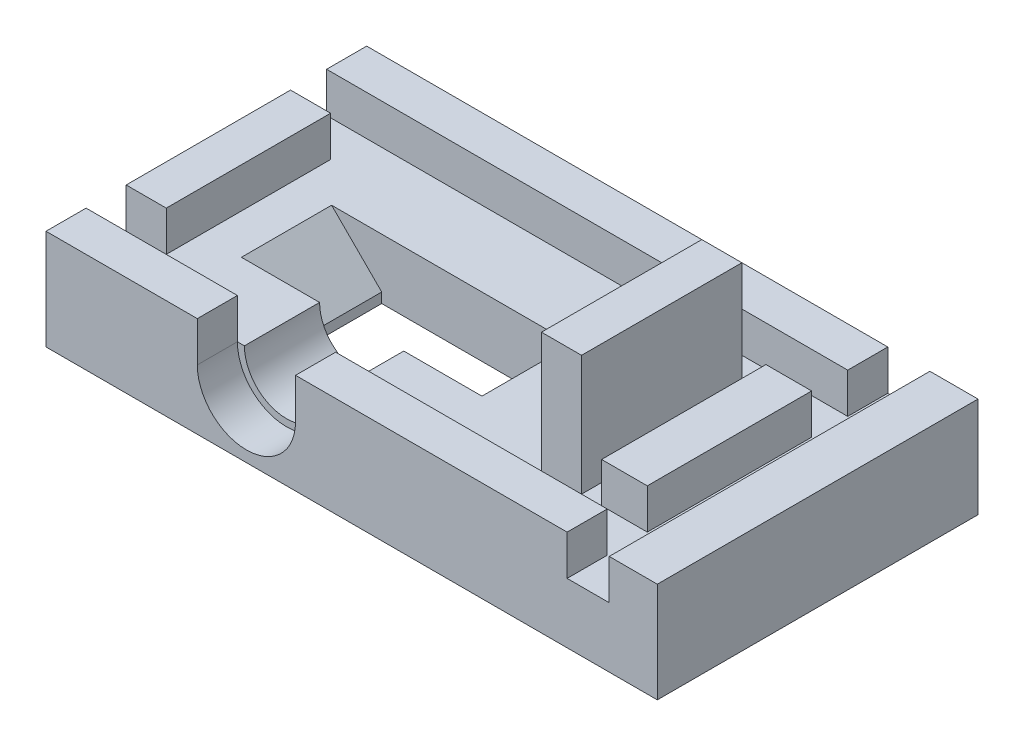
from build123d import *

# Parameters (mm, degrees)
BOSS_EXTRUDE1_DEPTH      = 2
BOSS_EXTRUDE1_DEPTH_BACK = 1
SKETCH1_W                = 30.5
SKETCH1_H                = 16
SKETCH2_W                = 2.4
SKETCH2_H                = 16
SKETCH2_W_2              = 26
SKETCH2_H_2              = 2
SKETCH2_W_3              = 2
SKETCH2_H_3              = 8.2
SKETCH2_W_4              = 2.279749354
BOSS_EXTRUDE2_DEPTH      = 2
SKETCH3_W                = 2
SKETCH3_H                = 8
BOSS_EXTRUDE3_DEPTH      = 6
SKETCH4_W                = 7
SKETCH4_H                = 4.5
CUT_EXTRUDE1_DEPTH       = 3
CUT_EXTRUDE2_DEPTH       = 7
CUT_EXTRUDE3_DEPTH       = 2
CHAMFER1_SIZE            = 2.5


with BuildPart() as part:
    # Sketch1 → Boss-Extrude1 (new, two sides: drawn at the far end of the back side and taken through both)
    with BuildSketch(Plane(origin=(0, 0, 0), x_dir=(1, 0, 0), z_dir=(0, 1, 0)).offset(-BOSS_EXTRUDE1_DEPTH_BACK)):
        Rectangle(SKETCH1_W, SKETCH1_H)
    extrude(amount=BOSS_EXTRUDE1_DEPTH + BOSS_EXTRUDE1_DEPTH_BACK)

    # Sketch2 → Boss-Extrude2 (add)
    with BuildSketch(Plane(origin=(0, 2, 0), x_dir=(1, 0, 0), z_dir=(0, 1, 0))):
        with Locations((14.05, 0)):
            Rectangle(SKETCH2_W, SKETCH2_H)
        with Locations((-2.25, 7)):
            Rectangle(SKETCH2_W_2, SKETCH2_H_2)
        with Locations((-2.25, -7)):
            Rectangle(SKETCH2_W_2, SKETCH2_H_2)
        with Locations((-14.25, 0.1)):
            Rectangle(SKETCH2_W_3, SKETCH2_H_3)
        with Locations((9.610125323, 0.1)):
            Rectangle(SKETCH2_W_4, SKETCH2_H_3)
    extrude(amount=BOSS_EXTRUDE2_DEPTH)

    # Sketch3 → Boss-Extrude3 (add)
    with BuildSketch(Plane(origin=(0, 2, 0), x_dir=(1, 0, 0), z_dir=(0, 1, 0))):
        with Locations((6.470250646, 0)):
            Rectangle(SKETCH3_W, SKETCH3_H)
    extrude(amount=BOSS_EXTRUDE3_DEPTH)

    # Sketch4 → Cut-Extrude1 (cut)
    with BuildSketch(Plane(origin=(0, 2, 0), x_dir=(1, 0, 0), z_dir=(0, 1, 0))):
        with Locations((-5.25, 0)):
            Rectangle(SKETCH4_W, SKETCH4_H)
    extrude(amount=-CUT_EXTRUDE1_DEPTH, mode=Mode.SUBTRACT)

    # Sketch5 → Cut-Extrude2 (cut)
    with BuildSketch(Plane(origin=(0, 0, 8), x_dir=(-1, 0, 0), z_dir=(0, 0, -1))):
        with BuildLine():
            Line((3.15, 2), (3.15, 4.2))
            Line((3.15, 4.2), (7.35, 4.2))
            Line((7.35, 4.2), (7.35, 2))
            ThreePointArc((7.35, 2), (5.25, -0.1), (3.15, 2))
        make_face()
    extrude(amount=CUT_EXTRUDE2_DEPTH, mode=Mode.SUBTRACT)

    # Sketch6 → Cut-Extrude3 (cut)
    with BuildSketch(Plane.XY.offset(8)):
        with BuildLine():
            Line((-7.7, 4), (-7.7, 2))
            ThreePointArc((-7.7, 2), (-5.25, -0.45), (-2.8, 2))
            Line((-2.8, 2), (-2.8, 4))
            Line((-2.8, 4), (-3, 4))
            Line((-3, 4), (-7.5, 4))
            Line((-7.5, 4), (-7.7, 4))
        make_face()
    extrude(amount=-CUT_EXTRUDE3_DEPTH, mode=Mode.SUBTRACT)

    # Chamfer1
    chamfer1_edges = [part.edges().sort_by_distance(p)[0] for p in [
        (-1.75, 2, 0),
        (-8.75, 2, 0),
    ]]
    chamfer(chamfer1_edges, length=CHAMFER1_SIZE)


solid = part.part
